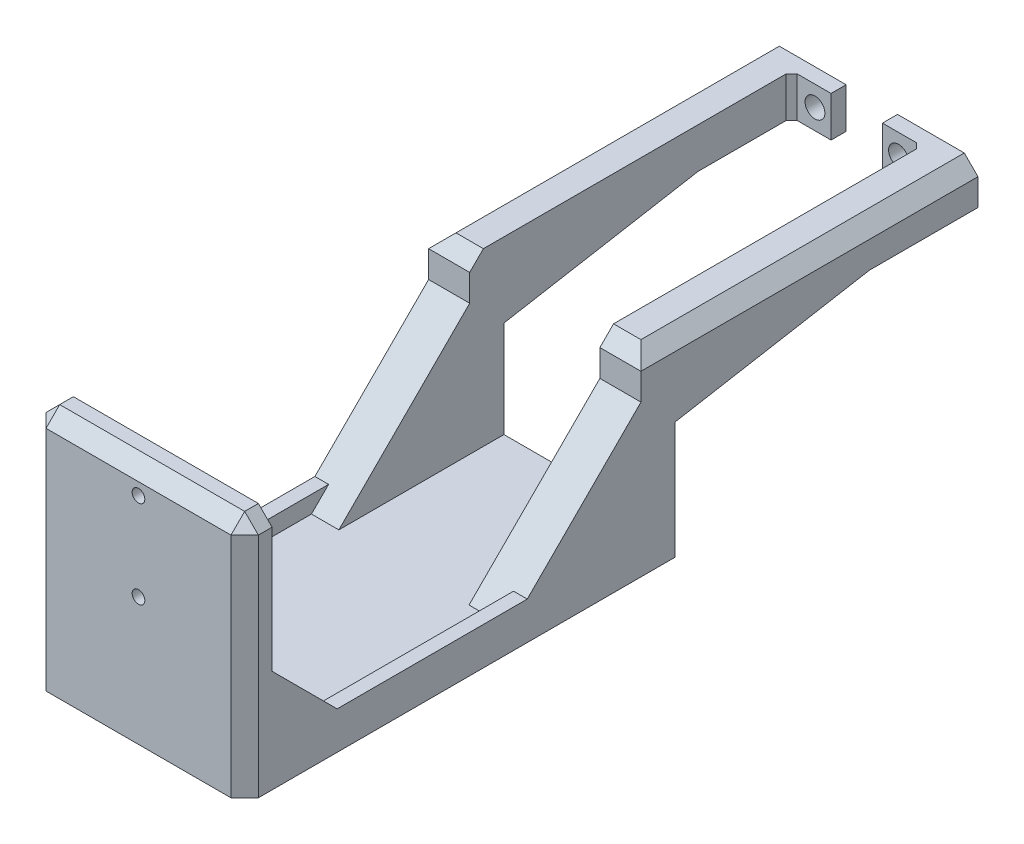
from build123d import *

# Parameters (mm, degrees)
SKETCH1_R             = 1.45
BOSS_EXTRUDE1_DEPTH   = 2.2
BOSS_EXTRUDE1_2_DEPTH = 2.2
SKETCH8_W             = 6
SKETCH8_H             = 5.9
BOSS_EXTRUDE6_DEPTH   = 42
BOSS_EXTRUDE7_DEPTH   = 5
SKETCH10_W            = 31
SKETCH10_H            = 3
BOSS_EXTRUDE8_DEPTH   = 53.85
SKETCH11_W            = 31
SKETCH11_H            = 35.214875224
SKETCH11_R            = 0.925
BOSS_EXTRUDE9_DEPTH   = 4
CHAMFER6_SIZE         = 19.1
CHAMFER7_SIZE         = 12
CHAMFER8_SIZE         = 2
CUT_EXTRUDE2_START    = 2
CUT_EXTRUDE2_DEPTH    = 27
CHAMFER10_SIZE        = 0.8
SKETCH14_W            = 7.5
SKETCH14_H            = 5.9
CUT_EXTRUDE3_DEPTH    = 112.547893301
CHAMFER11_SIZE        = 5
CHAMFER11_SIZE2       = 28.356409098
SKETCH15_W            = 2
SKETCH15_H            = 27.75
BOSS_EXTRUDE10_DEPTH  = 2.5


with BuildPart() as part:
    # Sketch1 → Boss-Extrude1 (new body)
    with BuildSketch(Plane.XY):
        Polygon((0, 0), (0, 5.9), (12.25, 5.9), (12.25, 0), (2.5, 0), align=None)
        with Locations((9.4, 2.95)):
            Circle(SKETCH1_R, mode=Mode.SUBTRACT)
    extrude(amount=BOSS_EXTRUDE1_DEPTH)



with BuildPart() as body_2:
    # Sketch1 → Boss-Extrude1 2 (new body)
    with BuildSketch(Plane.XY):
        Polygon((31, 0), (31, 5.9), (18.75, 5.9), (18.75, 0), (28.5, 0), align=None)
        with Locations((21.6, 2.95)):
            Circle(SKETCH1_R, mode=Mode.SUBTRACT)
    extrude(amount=BOSS_EXTRUDE1_2_DEPTH)


with BuildPart() as part_1:
    add(part.part)

    add(body_2.part)  # Boss-Extrude6 merges body 2
    # Sketch8 → Boss-Extrude6 (add)
    with BuildSketch(Plane.XY.offset(2.2)):
        with Locations((3, 2.95)):
            Rectangle(SKETCH8_W, SKETCH8_H)
        with Locations((28, 2.95)):
            Rectangle(SKETCH8_W, SKETCH8_H)
    extrude(amount=BOSS_EXTRUDE6_DEPTH)

    # Sketch9 → Boss-Extrude7 (add)
    with BuildSketch(Plane.XY.offset(44.2)):
        Polygon((0, 5.9), (0, -22.1), (31, -22.1), (31, 5.9), (25, 5.9), (25, -19.1), (6, -19.1), (6, 5.9), align=None)
    extrude(amount=BOSS_EXTRUDE7_DEPTH)

    # Sketch10 → Boss-Extrude8 (add)
    with BuildSketch(Plane.XY.offset(49.2)):
        with Locations((15.5, -20.6)):
            Rectangle(SKETCH10_W, SKETCH10_H)
    extrude(amount=BOSS_EXTRUDE8_DEPTH)

    # Sketch11 → Boss-Extrude9 (add)
    with BuildSketch(Plane.XY.offset(103.05)):
        with Locations((15.5, -4.492562388)):
            Rectangle(SKETCH11_W, SKETCH11_H)
        with Locations((15.5, -3.45)):
            Circle(SKETCH11_R, mode=Mode.SUBTRACT)
        with Locations(Location((15.5, 9.35, 0), (0, 0, 180))):
            Circle(SKETCH11_R, mode=Mode.SUBTRACT)
    extrude(amount=BOSS_EXTRUDE9_DEPTH)

    # Chamfer6
    chamfer6_edges = [part_1.edges().sort_by_distance(p)[0] for p in [
        (3, -19.1, 49.2),
        (28, -19.1, 49.2),
    ]]
    chamfer(chamfer6_edges, length=CHAMFER6_SIZE)

    # Chamfer7
    chamfer7_edges = [part_1.edges().sort_by_distance(p)[0] for p in [
        (15.5, -19.1, 103.05),
    ]]
    chamfer(chamfer7_edges, length=CHAMFER7_SIZE)

    # Chamfer8
    chamfer8_edges = [part_1.edges().sort_by_distance(p)[0] for p in [
        (0, -4.492562388, 107.05),
        (31, -4.492562388, 107.05),
        (15.5, 13.114875224, 107.05),
        (0, 13.114875224, 105.05),
        (31, 13.114875224, 105.05),
        (31, 5.9, 24.6),
        (3, 5.9, 49.2),
        (28, 5.9, 49.2),
        (0, 5.9, 24.6),
    ]]
    chamfer(chamfer8_edges, length=CHAMFER8_SIZE)

    # Sketch13 → Cut-Extrude2 (cut)
    with BuildSketch(Plane(origin=(0, 0, 0), x_dir=(0, 0, -1), z_dir=(1, 0, 0)).offset(CUT_EXTRUDE2_START)):
        Polygon((-103.05, -7.1), (-91.05, -19.1), (-103.05, -19.1), align=None)
    extrude(amount=CUT_EXTRUDE2_DEPTH, mode=Mode.SUBTRACT)

    # Chamfer10
    chamfer10_edges = [part_1.edges().sort_by_distance(p)[0] for p in [
        (6, 2.95, 2.2),
        (25, 2.95, 2.2),
    ]]
    chamfer(chamfer10_edges, length=CHAMFER10_SIZE)

    # Sketch14 → Cut-Extrude3 (cut, through all)
    with BuildSketch(Plane.XY.offset(2.2)):
        with Locations((15.5, 2.95)):
            Rectangle(SKETCH14_W, SKETCH14_H)
    extrude(amount=-CUT_EXTRUDE3_DEPTH, mode=Mode.SUBTRACT)

    # Chamfer11
    chamfer11_edges = [part_1.edges().sort_by_distance(p)[0] for p in [
        (3, 0, 44.2),
        (28, 0, 44.2),
    ]]
    chamfer11_side = [part_1.faces().sort_by_distance(p)[0] for p in [
        (3, -0.380711177, 44.2),
    ]]
    chamfer(chamfer11_edges, length=CHAMFER11_SIZE, length2=CHAMFER11_SIZE2, reference=chamfer11_side[0])

    # Sketch15 → Boss-Extrude10 (add)
    with BuildSketch(Plane(origin=(0, -19.1, 0), x_dir=(1, 0, 0), z_dir=(0, 1, 0))):
        with Locations((1, -79.675)):
            Rectangle(SKETCH15_W, SKETCH15_H)
        with Locations((30, -79.675)):
            Rectangle(SKETCH15_W, SKETCH15_H)
    extrude(amount=BOSS_EXTRUDE10_DEPTH)


solid = part_1.part
